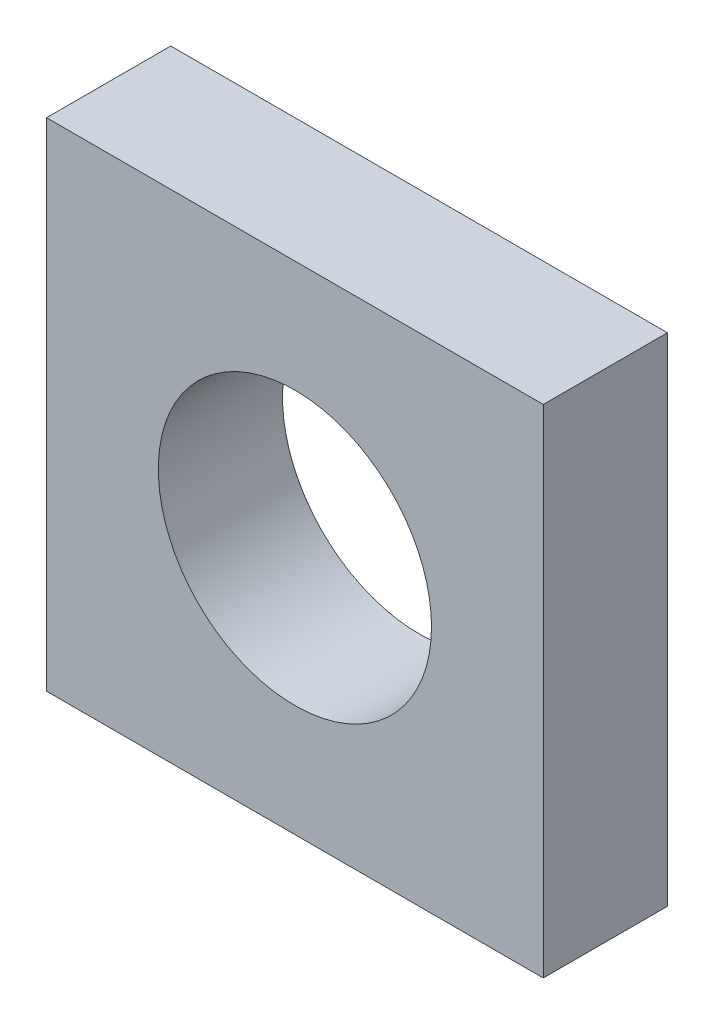
from build123d import *

# Parameters (mm, degrees)
SKETCH1_W           = 40
SKETCH1_H           = 40
SKETCH1_R           = 11
BOSS_EXTRUDE1_DEPTH = 10


with BuildPart() as part:
    # Sketch1 → Boss-Extrude1 (new body)
    with BuildSketch(Plane.XY):
        Rectangle(SKETCH1_W, SKETCH1_H)
        Circle(SKETCH1_R, mode=Mode.SUBTRACT)
    extrude(amount=BOSS_EXTRUDE1_DEPTH)


solid = part.part
